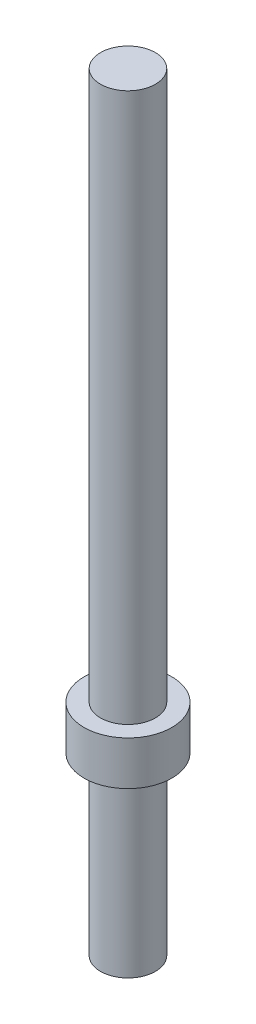
from build123d import *

# Parameters (mm, degrees)
SKETCH1_R           = 2.5
BOSS_EXTRUDE1_DEPTH = 50
SKETCH2_R           = 4
BOSS_EXTRUDE2_DEPTH = 4
BOSS_EXTRUDE3_START = -20
SKETCH3_R           = 2.5
BOSS_EXTRUDE3_DEPTH = 20


with BuildPart() as part:
    # Sketch1 → Boss-Extrude1 (new body)
    with BuildSketch(Plane(origin=(0, 0, 0), x_dir=(1, 0, 0), z_dir=(0, 1, 0))):
        with Locations(Location((0, 0, 0), (0, 0, 270))):
            Circle(SKETCH1_R)
    extrude(amount=BOSS_EXTRUDE1_DEPTH)

    # Sketch2 → Boss-Extrude2 (add)
    with BuildSketch(Plane(origin=(0, 0, 0), x_dir=(1, 0, 0), z_dir=(0, 1, 0))):
        with Locations(Location((0, 0, 0), (0, 0, 270))):
            Circle(SKETCH2_R)
    extrude(amount=-BOSS_EXTRUDE2_DEPTH)

    # Sketch3 → Boss-Extrude3 (add)
    with BuildSketch(Plane(origin=(0, 0, 0), x_dir=(1, 0, 0), z_dir=(0, 1, 0)).offset(BOSS_EXTRUDE3_START)):
        with Locations(Location((0, 0, 0), (0, 0, 270))):
            Circle(SKETCH3_R)
    extrude(amount=BOSS_EXTRUDE3_DEPTH)


solid = part.part
